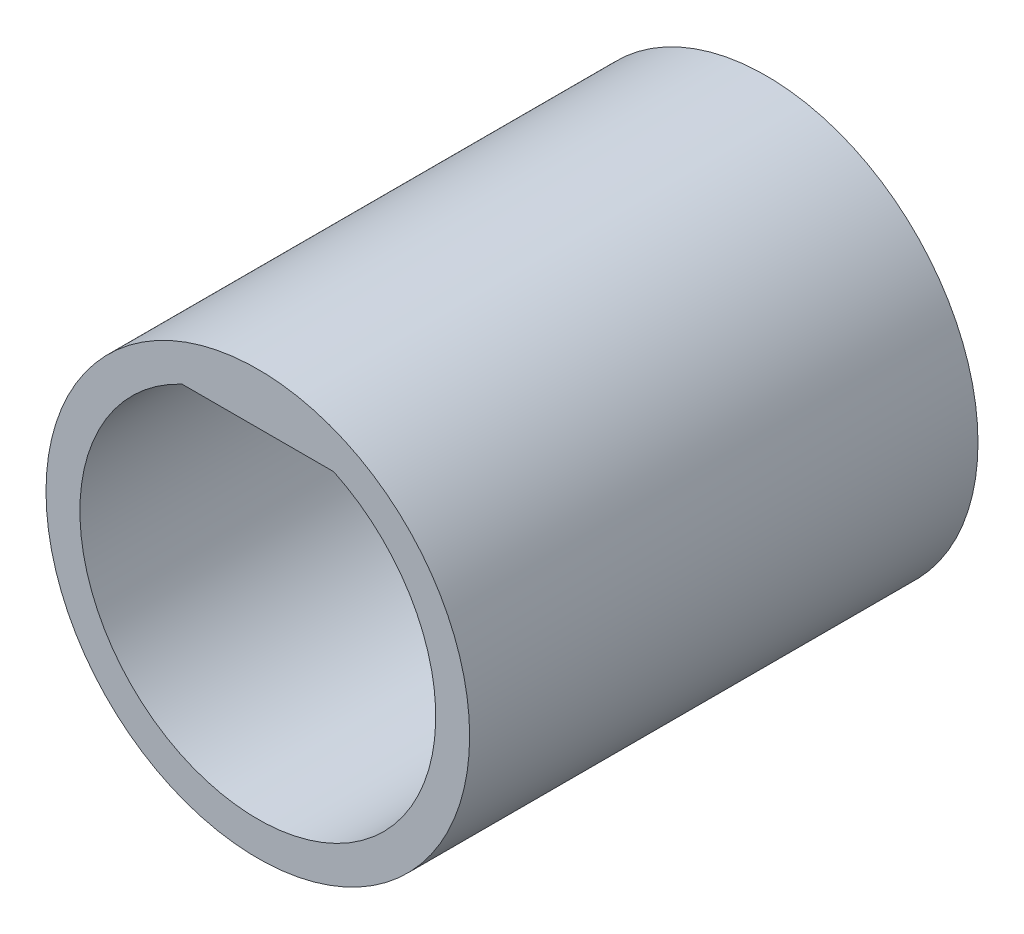
from build123d import *

# Parameters (mm, degrees)
SKETCH1_R           = 3.175
BOSS_EXTRUDE1_DEPTH = 7.62


with BuildPart() as part:
    # Sketch1 → Boss-Extrude1 (new body)
    with BuildSketch(Plane.XY):
        with Locations(Location((0, 0, 0), (0, 0, 180))):
            Circle(SKETCH1_R)
        with BuildLine():
            Line((-1.135922533, 2.413), (1.135922533, 2.413))
            ThreePointArc((1.135922533, 2.413), (0, -2.667), (-1.135922533, 2.413))
        make_face(mode=Mode.SUBTRACT)
    extrude(amount=BOSS_EXTRUDE1_DEPTH)


solid = part.part
